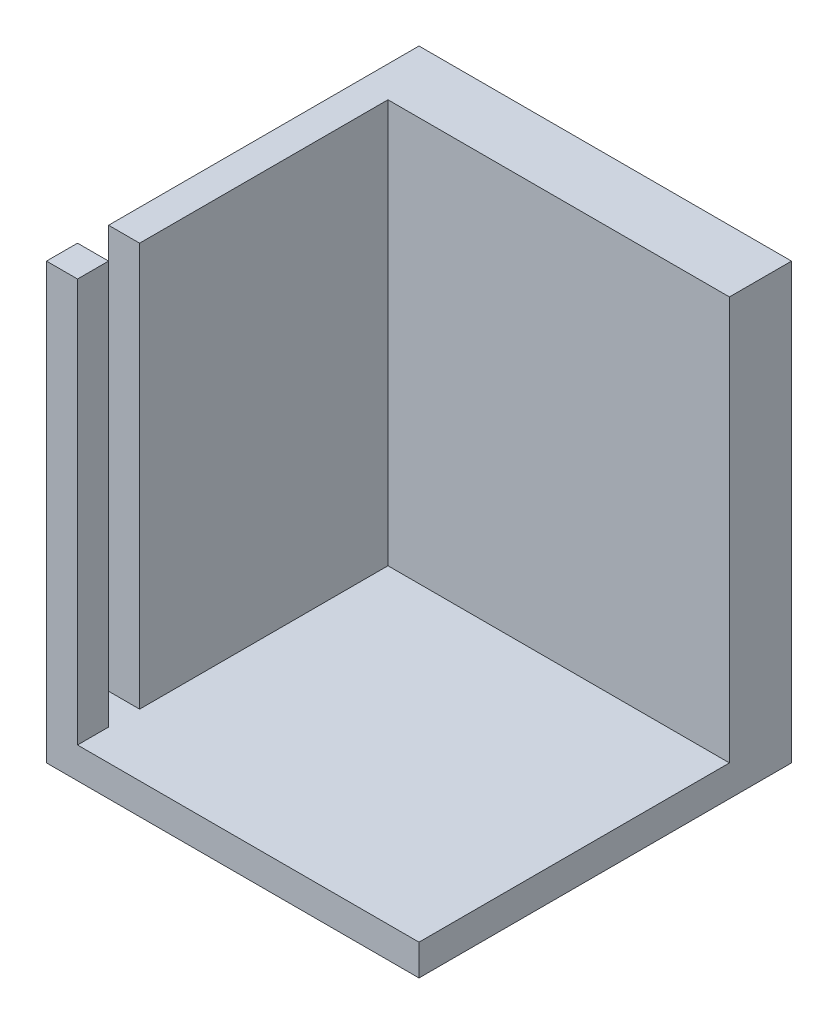
from build123d import *

# Parameters (mm, degrees)
SKETCH1_W                      = 670
SKETCH1_H                      = 120
BOSS_EXTRUDE1_DEPTH            = 530
SKETCH2_W                      = 100
SKETCH2_H                      = 200
SKETCH2_W_2                    = 650
SKETCH2_H_2                    = 250
CUT_EXTRUDE1_DEPTH             = 100
SKETCH3_R                      = 50
CUT_EXTRUDE2_DEPTH             = 260
F_12_0_12_DIAMETER_HOLE2_D     = 12
F_12_0_12_DIAMETER_HOLE2_DEPTH = 30
F_12_0_12_DIAMETER_HOLE2_TIP   = 3.605163714
SKETCH8_W                      = 650
SKETCH8_H                      = 50
BOSS_EXTRUDE2_DEPTH            = 5
SKETCH9_W                      = 10
SKETCH9_H                      = 250
CUT_EXTRUDE3_DEPTH             = 717
CUT_EXTRUDE4_DEPTH             = 5
SKETCH11_W                     = 10
SKETCH11_H                     = 100
BOSS_EXTRUDE3_DEPTH            = 78
BOSS_EXTRUDE3_2_DEPTH          = 78
BOSS_EXTRUDE3_3_DEPTH          = 78
SKETCH12_W                     = 20
SKETCH12_H                     = 30
CUT_EXTRUDE5_DEPTH             = 80
SKETCH15_W                     = 30
SKETCH15_H                     = 23.536156656
SKETCH15_H_2                   = 28.986603691
CUT_EXTRUDE7_DEPTH             = 35
SHELL1_T                       = -3
SKETCH16_W                     = 14
SKETCH16_H                     = 14
CUT_EXTRUDE8_DEPTH             = 35
SKETCH17_W                     = 5.729882812
SKETCH17_H                     = 17.428393554
SKETCH17_W_2                   = 13.369726562
SKETCH17_H_2                   = 3.342431641
BOSS_EXTRUDE4_DEPTH            = 5
CUT_EXTRUDE10_DEPTH            = 863.670273187
CUT_EXTRUDE10_DEPTH_BACK       = 863.670273187
SKETCH18_W                     = 670
SKETCH18_H                     = 250
CUT_EXTRUDE11_DEPTH            = 734.007503372
CUT_EXTRUDE11_DEPTH_BACK       = 734.007503372
SKETCH19_W                     = 550
SKETCH19_H                     = 280
CUT_EXTRUDE12_DEPTH            = 321.624390838
CUT_EXTRUDE12_DEPTH_BACK       = 321.624390838
SKETCH20_W                     = 120
SKETCH20_H                     = 140


with BuildPart() as part:
    # Sketch1 → Boss-Extrude1 (new body)
    with BuildSketch(Plane(origin=(0, 0, 0), x_dir=(1, 0, 0), z_dir=(0, 1, 0))):
        with Locations((335, 60)):
            Rectangle(SKETCH1_W, SKETCH1_H)
    extrude(amount=BOSS_EXTRUDE1_DEPTH)

    # Sketch2 → Cut-Extrude1 (cut)
    with BuildSketch(Plane.XY):
        with Locations((60, 380)):
            Rectangle(SKETCH2_W, SKETCH2_H)
        with Locations((170, 380)):
            Rectangle(SKETCH2_W, SKETCH2_H)
        with Locations((280, 380)):
            Rectangle(SKETCH2_W, SKETCH2_H)
        with Locations((390, 380)):
            Rectangle(SKETCH2_W, SKETCH2_H)
        with Locations((500, 380)):
            Rectangle(SKETCH2_W, SKETCH2_H)
        with Locations((610, 380)):
            Rectangle(SKETCH2_W, SKETCH2_H)
        with Locations((335, 135)):
            Rectangle(SKETCH2_W_2, SKETCH2_H_2)
    extrude(amount=-CUT_EXTRUDE1_DEPTH, mode=Mode.SUBTRACT)

    # Sketch3 → Cut-Extrude2 (cut)
    with BuildSketch(Plane(origin=(0, 530, 0), x_dir=(1, 0, 0), z_dir=(0, 1, 0))):
        with Locations(Location((60, 60, 0), (0, 0, 270))):
            Circle(SKETCH3_R)
        with Locations(Location((170, 60, 0), (0, 0, 270))):
            Circle(SKETCH3_R)
        with Locations(Location((280, 60, 0), (0, 0, 270))):
            Circle(SKETCH3_R)
        with Locations(Location((390, 60, 0), (0, 0, 270))):
            Circle(SKETCH3_R)
        with Locations(Location((500, 60, 0), (0, 0, 270))):
            Circle(SKETCH3_R)
        with Locations(Location((610, 60, 0), (0, 0, 270))):
            Circle(SKETCH3_R)
    extrude(amount=-CUT_EXTRUDE2_DEPTH, mode=Mode.SUBTRACT)

    # Ø12.0 (12) Diameter Hole2
    with Locations(Plane(origin=(59.704642413, 270, -102.411697903), x_dir=(0, 0, 1), z_dir=(0, 1, 0))):
        with Locations((0, 0), (-0.195888006, 111.8520513), (0.014838595, 221.167624818), (-0.341843303, 331.364008353), (0.657723149, 441.008646429), (1.288998006, 549.811854685)):
            Hole(F_12_0_12_DIAMETER_HOLE2_D / 2, depth=F_12_0_12_DIAMETER_HOLE2_DEPTH)
            with Locations((0, 0, -(F_12_0_12_DIAMETER_HOLE2_DEPTH + F_12_0_12_DIAMETER_HOLE2_TIP / 2))):  # 118° drill point
                Cone(0, F_12_0_12_DIAMETER_HOLE2_D / 2, F_12_0_12_DIAMETER_HOLE2_TIP, mode=Mode.SUBTRACT)

    # Sketch8 → Boss-Extrude2 (add)
    with BuildSketch(Plane.XY):
        with Locations((335, 305)):
            Rectangle(SKETCH8_W, SKETCH8_H)
    extrude(amount=-BOSS_EXTRUDE2_DEPTH)

    # Sketch9 → Cut-Extrude3 (cut)
    with BuildSketch(Plane(origin=(670, 0, 0), x_dir=(0, 0, -1), z_dir=(1, 0, 0))):
        with Locations((15, 135)):
            Rectangle(SKETCH9_W, SKETCH9_H)
    extrude(amount=-CUT_EXTRUDE3_DEPTH, mode=Mode.SUBTRACT)

    # Sketch10 → Cut-Extrude4 (cut)
    with BuildSketch(Plane(origin=(0, 10, 0), x_dir=(1, 0, 0), z_dir=(0, 1, 0))):
        Polygon((365, 61.943560596), (350, 87.924322709), (320, 87.924322709), (305, 61.943560596), (320, 35.962798482), (350, 35.962798482), align=None)
    extrude(amount=-CUT_EXTRUDE4_DEPTH, mode=Mode.SUBTRACT)

    # Sketch12 → Cut-Extrude5 (cut)
    with BuildSketch(Plane.XY.offset(-100)):
        with Locations((85.198613037, 245)):
            Rectangle(SKETCH12_W, SKETCH12_H)
        with Locations((195.198613037, 245)):
            Rectangle(SKETCH12_W, SKETCH12_H)
        with Locations((305.198613037, 245)):
            Rectangle(SKETCH12_W, SKETCH12_H)
        with Locations((415.198613037, 245)):
            Rectangle(SKETCH12_W, SKETCH12_H)
        with Locations((525.198613037, 245)):
            Rectangle(SKETCH12_W, SKETCH12_H)
        with Locations((635.198613037, 245)):
            Rectangle(SKETCH12_W, SKETCH12_H)
    extrude(amount=-CUT_EXTRUDE5_DEPTH, mode=Mode.SUBTRACT)

    # Sketch17 → Boss-Extrude4 (add)
    # profile 1 of 9: a face of its own
    with BuildSketch(Plane.XY):
        with BuildLine():
            Line((527.508830928, 289.835452458), (527.508830928, 307.263846012))
            Line((527.508830928, 307.263846012), (534.861434459, 307.263846012))
            add(Edge.make_bspline(
                [(534.861434459, 307.263846012), (535.181337774, 307.258256848), (535.803061116, 307.24739446), (536.703508491, 307.139069344), (537.544992916, 306.975202489), (538.325061607, 306.737496792), (539.040841948, 306.426020155), (539.698044515, 306.051894954), (540.290333057, 305.605079277), (540.822348212, 305.090232636), (541.284521701, 304.502523111), (541.692171296, 303.852565801), (542.030284458, 303.129762281), (542.309377095, 302.341316546), (542.5243908, 301.484161689), (542.679660381, 300.560045938), (542.773357357, 299.567500804), (542.783368073, 298.883107022), (542.788518428, 298.530997273)],
                knots=[0, 0, 0, 0, 1.135059408, 2.20595691, 3.214417064, 4.174978569, 5.094187092, 5.980001006, 6.853065862, 7.720814779, 8.600404634, 9.50058483, 10.438414914, 11.426825708, 12.465239141, 13.571113463, 14.750376389, 16, 16, 16, 16], degree=3))
            add(Edge.make_bspline(
                [(542.788518428, 298.530997273), (542.781740751, 298.180151665), (542.768592871, 297.499553336), (542.676885992, 296.511518461), (542.516733301, 295.591080531), (542.296748778, 294.736450427), (542.003051046, 293.953120444), (541.654236167, 293.233205539), (541.233025793, 292.585291498), (540.753136904, 292.000029304), (540.204772188, 291.484681411), (539.587651059, 291.044279297), (538.910779309, 290.668464036), (538.169670382, 290.361903209), (537.364073889, 290.124869172), (536.495133477, 289.954199984), (535.562644449, 289.853487388), (534.920131033, 289.841584621), (534.58911581, 289.835452458)],
                knots=[0, 0, 0, 0, 1.228418252, 2.382983832, 3.470276728, 4.496757894, 5.468023682, 6.394867725, 7.292157164, 8.167372942, 9.039072913, 9.918728341, 10.815246345, 11.744296628, 12.720973084, 13.750736166, 14.841206188, 16, 16, 16, 16], degree=3))
            Line((534.58911581, 289.835452458), (527.508830928, 289.835452458))
        make_face()
        with BuildLine():
            Line((533.238713741, 291.745413395), (534.048208904, 291.745413395))
            add(Edge.make_bspline(
                [(534.048208904, 291.745413395), (534.172894012, 291.749291978), (534.413033311, 291.756761998), (534.758676231, 291.825976613), (535.075745017, 291.938271137), (535.365749176, 292.094802589), (535.623404602, 292.300450923), (535.848862806, 292.551404902), (536.04776914, 292.844737637), (536.217685755, 293.190205032), (536.364284647, 293.596533622), (536.481764702, 294.076367921), (536.592118304, 294.630928744), (536.673672739, 295.265507643), (536.740044562, 295.978448886), (536.788346679, 296.768428292), (536.812018936, 297.636801208), (536.817188964, 298.241258393), (536.819890499, 298.55711002)],
                knots=[0, 0, 0, 0, 0.728710832, 1.403472396, 2.052289494, 2.690292559, 3.321919393, 3.970736491, 4.656696891, 5.388631723, 6.217040872, 7.17856157, 8.275589967, 9.523440737, 10.918935818, 12.463926104, 14.152268318, 16, 16, 16, 16], degree=3))
            add(Edge.make_bspline(
                [(536.819890499, 298.55711002), (536.8171426, 298.871715251), (536.811863063, 299.476166083), (536.7886758, 300.343334385), (536.739579947, 301.133216935), (536.674703848, 301.843934916), (536.589660404, 302.476324031), (536.488366458, 303.031681737), (536.362441588, 303.507627045), (536.222158727, 303.914921549), (536.050140993, 304.256514038), (535.858357073, 304.554097881), (535.62547107, 304.79746827), (535.36991257, 305.004888479), (535.079348843, 305.160875844), (534.761320266, 305.273944358), (534.414185903, 305.34216807), (534.172870641, 305.349893944), (534.048208904, 305.353885075)],
                knots=[0, 0, 0, 0, 1.842836665, 3.540640921, 5.080358154, 6.47765669, 7.719902824, 8.816971715, 9.781579111, 10.601733135, 11.334613876, 12.017393917, 12.666641099, 13.29908421, 13.937911793, 14.587567384, 15.270347425, 16, 16, 16, 16], degree=3))
            Line((534.048208904, 305.353885075), (533.238713741, 305.353885075))
            Line((533.238713741, 305.353885075), (533.238713741, 291.745413395))
        make_face(mode=Mode.SUBTRACT)
    # profile 2 of 9: a face of its own
    with BuildSketch(Plane.XY):
        with Locations((547.563420772, 298.549649235)):
            Rectangle(SKETCH17_W, SKETCH17_H)
    # profile 3 of 9: a face of its own
    with BuildSketch(Plane.XY):
        Polygon((564.514324092, 307.263846012), (564.514324092, 305.115139958), (558.545696163, 305.115139958), (558.545696163, 299.862747379), (563.559343624, 299.862747379), (563.559343624, 297.714041325), (558.545696163, 297.714041325), (558.545696163, 289.835452458), (552.81581335, 289.835452458), (552.81581335, 307.263846012), align=None)
    # profile 4 of 9: a face of its own
    with BuildSketch(Plane.XY):
        Polygon((577.645305538, 307.263846012), (577.645305538, 305.115139958), (571.676677608, 305.115139958), (571.676677608, 299.862747379), (576.690325069, 299.862747379), (576.690325069, 297.714041325), (571.676677608, 297.714041325), (571.676677608, 289.835452458), (565.946794795, 289.835452458), (565.946794795, 307.263846012), align=None)
    # profile 5 of 9: a face of its own
    with BuildSketch(Plane.XY):
        with Locations((584.330168819, 287.448001286)):
            Rectangle(SKETCH17_W_2, SKETCH17_H_2)
    # profile 6 of 9: a face of its own
    with BuildSketch(Plane.XY):
        with BuildLine():
            Line((605.578484249, 307.263846012), (605.578484249, 295.602639195))
            add(Edge.make_bspline(
                [(605.578484249, 295.602639195), (605.574209777, 295.35989389), (605.565919345, 294.889083964), (605.480877158, 294.20653885), (605.349958188, 293.569747554), (605.15926554, 292.978838165), (604.911867049, 292.436847071), (604.616163877, 291.936663973), (604.260702644, 291.487723021), (603.847299908, 291.08966617), (603.386881991, 290.731670113), (602.867295001, 290.425440037), (602.293741958, 290.168488385), (601.66690529, 289.960990771), (600.988052682, 289.797299786), (600.254912883, 289.679078851), (599.467035781, 289.60781007), (598.923618241, 289.60048219), (598.643684673, 289.59670734)],
                knots=[0, 0, 0, 0, 1.108173197, 2.149326602, 3.136215123, 4.073726706, 4.978516626, 5.852185058, 6.72141202, 7.584905625, 8.467554395, 9.379216169, 10.332422268, 11.332766067, 12.390653242, 13.518530507, 14.721707419, 16, 16, 16, 16], degree=3))
            add(Edge.make_bspline(
                [(598.643684673, 289.59670734), (598.373688491, 289.600411437), (597.851346557, 289.607577482), (597.093280473, 289.679448684), (596.387523889, 289.797736542), (595.733050135, 289.960122315), (595.130189942, 290.169220301), (594.579048171, 290.42623041), (594.078350789, 290.732835498), (593.633858028, 291.090104794), (593.234289459, 291.486851767), (592.899913678, 291.940746827), (592.609043638, 292.435866034), (592.375223767, 292.980322997), (592.191754821, 293.570441519), (592.063541006, 294.20666921), (591.983676196, 294.889343196), (591.974661767, 295.359932437), (591.970012569, 295.602639195)],
                knots=[0, 0, 0, 0, 1.258901956, 2.435505865, 3.547148904, 4.59359074, 5.576649289, 6.5183682, 7.424469602, 8.307507093, 9.172751023, 10.042627298, 10.928839176, 11.845659241, 12.799442865, 13.80597989, 14.868432463, 16, 16, 16, 16], degree=3))
            Line((591.970012569, 295.602639195), (591.970012569, 307.263846012))
            Line((591.970012569, 307.263846012), (597.699895381, 307.263846012))
            Line((597.699895381, 307.263846012), (597.699895381, 295.457153889))
            add(Edge.make_bspline(
                [(597.699895381, 295.457153889), (597.700816195, 295.287996189), (597.702584578, 294.963135903), (597.729908723, 294.499051493), (597.768241004, 294.079064133), (597.828226169, 293.705517832), (597.90066041, 293.377063412), (597.989882091, 293.09281535), (598.094998068, 292.852496478), (598.225239063, 292.654232043), (598.380826623, 292.495135011), (598.55368342, 292.353231761), (598.757556996, 292.238543846), (598.987648905, 292.146224908), (599.243380948, 292.070549638), (599.526120553, 292.020376099), (599.83553351, 291.990763905), (600.049971942, 291.986424568), (600.161954402, 291.984158512)],
                knots=[0, 0, 0, 0, 1.622370975, 3.115695595, 4.458049099, 5.666011203, 6.742434742, 7.681714947, 8.519814998, 9.250928664, 9.942747364, 10.646898194, 11.389596108, 12.175933929, 13.021386247, 13.943159715, 14.925891993, 16, 16, 16, 16], degree=3))
            add(Edge.make_bspline(
                [(600.161954402, 291.984158512), (600.283927219, 291.987190593), (600.521124756, 291.993087005), (600.86597014, 292.03390861), (601.187714881, 292.103380086), (601.484890424, 292.205377303), (601.758665297, 292.332852529), (602.012761516, 292.484567923), (602.236391413, 292.674631152), (602.439076761, 292.888441291), (602.620738276, 293.128529789), (602.771757722, 293.399928575), (602.905501548, 293.697121508), (603.005823683, 294.025060118), (603.089837826, 294.379999499), (603.146989706, 294.763086929), (603.186210275, 295.174074524), (603.189394751, 295.457053988), (603.191033077, 295.602639195)],
                knots=[0, 0, 0, 0, 1.083870311, 2.107775948, 3.08105344, 4.003637981, 4.893545291, 5.761570557, 6.624657808, 7.49233129, 8.376387281, 9.291996285, 10.246843261, 11.267344133, 12.334180325, 13.486053461, 14.706643157, 16, 16, 16, 16], degree=3))
            Line((603.191033077, 295.602639195), (603.191033077, 307.263846012))
            Line((603.191033077, 307.263846012), (605.578484249, 307.263846012))
        make_face()
    # profile 7 of 9: a face of its own
    with BuildSketch(Plane.XY):
        with BuildLine():
            Line((619.731593227, 302.015183827), (616.739818477, 301.526502415))
            add(Edge.make_bspline(
                [(616.739818477, 301.526502415), (616.748849224, 301.670726223), (616.765660669, 301.939210177), (616.78429066, 302.312269209), (616.796668381, 302.625642376), (616.798628236, 302.814722915), (616.799504756, 302.899286839)],
                knots=[0, 0, 0, 0, 1.261802504, 2.348944521, 3.261585937, 4, 4, 4, 4], degree=3))
            add(Edge.make_bspline(
                [(616.799504756, 302.899286839), (616.798306068, 303.007660677), (616.795968139, 303.219033721), (616.750451916, 303.523894877), (616.694806916, 303.811547356), (616.604352699, 304.076787391), (616.488181329, 304.320314265), (616.348943917, 304.543955606), (616.184187178, 304.745078709), (615.995833421, 304.928129987), (615.778009957, 305.083200131), (615.536269472, 305.218702836), (615.269765326, 305.333844758), (614.978065514, 305.431346685), (614.660683072, 305.504624438), (614.319025281, 305.556776695), (613.952471696, 305.585673441), (613.699597795, 305.590260771), (613.568984889, 305.592630192)],
                knots=[0, 0, 0, 0, 1.079280541, 2.105035848, 3.067950317, 3.99715044, 4.889989748, 5.753421302, 6.617030865, 7.476358039, 8.364190572, 9.274590025, 10.235106994, 11.254473582, 12.337095886, 13.478601727, 14.697662529, 16, 16, 16, 16], degree=3))
            add(Edge.make_bspline(
                [(613.568984889, 305.592630192), (613.391954632, 305.58912286), (613.059112606, 305.582528579), (612.595688488, 305.495339748), (612.198743126, 305.361419257), (611.87165349, 305.163811893), (611.613188167, 304.909795747), (611.433841092, 304.593316589), (611.323009072, 304.224665915), (611.313400221, 303.959558324), (611.308367061, 303.820693775)],
                knots=[0, 0, 0, 0, 1.294917039, 2.43462794, 3.440028966, 4.347597256, 5.210608309, 6.06356377, 6.985685997, 8, 8, 8, 8], degree=3))
            add(Edge.make_bspline(
                [(611.308367061, 303.820693775), (611.317562032, 303.705133219), (611.336106628, 303.472068433), (611.47315858, 303.132808312), (611.695999602, 302.811560885), (612.009295906, 302.510664216), (612.404107796, 302.221967273), (612.884407504, 301.948533431), (613.450813789, 301.688189695), (613.862519081, 301.536023727), (614.080048656, 301.455624958)],
                knots=[0, 0, 0, 0, 0.716839541, 1.445735977, 2.240793036, 3.131329288, 4.131129903, 5.273471266, 6.559404876, 8, 8, 8, 8], degree=3))
            add(Edge.make_bspline(
                [(614.080048656, 301.455624958), (614.335934702, 301.364918412), (614.834564244, 301.188164095), (615.547657928, 300.88707802), (616.213068388, 300.5749594), (616.829579094, 300.246613346), (617.397833174, 299.90520698), (617.914851624, 299.544556457), (618.386199073, 299.173962102), (618.807001026, 298.783874588), (619.177995113, 298.378100064), (619.4958685, 297.952745357), (619.771807525, 297.51723103), (619.991113975, 297.061458502), (620.169645242, 296.594624218), (620.292698657, 296.11024444), (620.364288243, 295.609761088), (620.37516617, 295.270864226), (620.380681514, 295.099036213)],
                knots=[0, 0, 0, 0, 1.359488612, 2.649152603, 3.874964776, 5.039588756, 6.146130126, 7.193090393, 8.194917302, 9.146793662, 10.063845301, 10.944476293, 11.803344532, 12.641736646, 13.473440096, 14.302714936, 15.139439897, 16, 16, 16, 16], degree=3))
            add(Edge.make_bspline(
                [(620.380681514, 295.099036213), (620.374476075, 294.902306495), (620.362285176, 294.515820995), (620.280160209, 293.948630617), (620.138011896, 293.409496554), (619.938489338, 292.895972278), (619.681049879, 292.411946655), (619.366518754, 291.954381076), (618.996510229, 291.525099427), (618.5710008, 291.128381035), (618.102222518, 290.765302239), (617.587803957, 290.450854345), (617.034458515, 290.187092261), (616.444107988, 289.968993032), (615.81453624, 289.801373099), (615.145337453, 289.685291013), (614.438790193, 289.606619894), (613.954683001, 289.600062276), (613.70700941, 289.59670734)],
                knots=[0, 0, 0, 0, 0.972121714, 1.909782367, 2.824924061, 3.721832975, 4.62620438, 5.527836938, 6.46026819, 7.421000932, 8.398101015, 9.385579713, 10.394244048, 11.422703992, 12.491421888, 13.608778581, 14.776629625, 16, 16, 16, 16], degree=3))
            add(Edge.make_bspline(
                [(613.70700941, 289.59670734), (613.445745367, 289.599650312), (612.939893069, 289.605348413), (612.207608113, 289.66709241), (611.525297432, 289.760984454), (610.893395078, 289.899706116), (610.309273131, 290.072394336), (609.776099392, 290.288320955), (609.295310255, 290.547303481), (608.863217672, 290.843007892), (608.478306623, 291.175775461), (608.148120946, 291.551766865), (607.86942369, 291.967163224), (607.639947144, 292.421521488), (607.466477665, 292.917583541), (607.339164663, 293.449829748), (607.264537999, 294.021332449), (607.254747521, 294.414908557), (607.249700069, 294.617815586)],
                knots=[0, 0, 0, 0, 1.342201143, 2.598733168, 3.773451092, 4.878874364, 5.91991243, 6.900006476, 7.829142054, 8.72062616, 9.585588575, 10.436728592, 11.283829734, 12.149664931, 13.044964919, 13.977937424, 14.957531465, 16, 16, 16, 16], degree=3))
            add(Edge.make_bspline(
                [(607.249700069, 294.617815586), (607.250803815, 294.692425759), (607.253213998, 294.855347393), (607.260452266, 295.122772538), (607.275636683, 295.433682216), (607.29037174, 295.656130545), (607.298195171, 295.774237248)],
                knots=[0, 0, 0, 0, 0.773500207, 1.689044709, 2.77302154, 4, 4, 4, 4], degree=3))
            Line((607.298195171, 295.774237248), (610.36457777, 296.337526509))
            add(Edge.make_bspline(
                [(610.36457777, 296.337526509), (610.326952988, 296.136337493), (610.255606535, 295.754830366), (610.178678473, 295.21219969), (610.124206629, 294.733311493), (610.11767002, 294.435147371), (610.114641475, 294.297001835)],
                knots=[0, 0, 0, 0, 1.192988372, 2.262218769, 3.194850416, 4, 4, 4, 4], degree=3))
            add(Edge.make_bspline(
                [(610.114641475, 294.297001835), (610.116191817, 294.183708768), (610.119182568, 293.965156219), (610.159053378, 293.648552813), (610.215988606, 293.352999663), (610.302906772, 293.079707227), (610.411206928, 292.826307836), (610.544682453, 292.59538211), (610.704385489, 292.386485019), (610.887496571, 292.200099922), (611.094689168, 292.033628705), (611.327456494, 291.892756696), (611.58347653, 291.771733922), (611.864681562, 291.677479524), (612.167961721, 291.596080628), (612.497219749, 291.548235723), (612.849461228, 291.512043782), (613.092629543, 291.508500084), (613.218327999, 291.506668278)],
                knots=[0, 0, 0, 0, 1.135776692, 2.191015738, 3.19649269, 4.151244236, 5.061952528, 5.956281389, 6.819534407, 7.692823504, 8.571441916, 9.478554956, 10.416037156, 11.406231466, 12.450054172, 13.561596327, 14.739541482, 16, 16, 16, 16], degree=3))
            add(Edge.make_bspline(
                [(613.218327999, 291.506668278), (613.423996012, 291.510791273), (613.810619321, 291.518541853), (614.349272542, 291.616708407), (614.810575885, 291.768742445), (615.189785268, 291.991387532), (615.490778961, 292.278756613), (615.698005174, 292.637320004), (615.824813318, 293.05638326), (615.837728413, 293.355975238), (615.844524288, 293.513619419)],
                knots=[0, 0, 0, 0, 1.308765556, 2.460272085, 3.475015317, 4.388076298, 5.239673503, 6.095681635, 6.997954785, 8, 8, 8, 8], degree=3))
            add(Edge.make_bspline(
                [(615.844524288, 293.513619419), (615.833808824, 293.638242951), (615.811807312, 293.894126055), (615.644884004, 294.264515838), (615.382382362, 294.620631473), (615.016807277, 294.962984909), (614.551376589, 295.293471235), (613.986957743, 295.616730224), (613.322148235, 295.933112033), (612.83677959, 296.119639164), (612.580430889, 296.21815395)],
                knots=[0, 0, 0, 0, 0.667930748, 1.371427933, 2.146459016, 3.034714139, 4.04893387, 5.207327294, 6.525042705, 8, 8, 8, 8], degree=3))
            add(Edge.make_bspline(
                [(612.580430889, 296.21815395), (612.374354345, 296.29679374), (611.970646869, 296.450850434), (611.394079385, 296.713586304), (610.853066711, 296.987016804), (610.357486361, 297.288235735), (609.896382561, 297.599610528), (609.477036946, 297.932256792), (609.09841673, 298.284556341), (608.758710772, 298.653375077), (608.457302107, 299.038989264), (608.199448649, 299.444659231), (607.977533299, 299.866789834), (607.798609588, 300.308107488), (607.65975715, 300.767821241), (607.559616231, 301.244439392), (607.497905054, 301.739995674), (607.491630423, 302.075933546), (607.488445186, 302.246468159)],
                knots=[0, 0, 0, 0, 1.249558333, 2.447906163, 3.58867143, 4.682264114, 5.731748367, 6.739728761, 7.711906036, 8.659384707, 9.578321416, 10.481344598, 11.379544271, 12.277135726, 13.175418307, 14.097160112, 15.034047388, 16, 16, 16, 16], degree=3))
            add(Edge.make_bspline(
                [(607.488445186, 302.246468159), (607.49282555, 302.439538736), (607.501402184, 302.817565692), (607.587451154, 303.36980586), (607.719291893, 303.894921371), (607.910558542, 304.389343064), (608.156192894, 304.852853762), (608.453187669, 305.288766511), (608.804241719, 305.697593471), (609.213503754, 306.066686531), (609.657214714, 306.407618241), (610.14376173, 306.697651931), (610.658716537, 306.950861947), (611.210636666, 307.148827868), (611.791820619, 307.313252612), (612.408080529, 307.421140415), (613.056315391, 307.490701612), (613.499160755, 307.498567824), (613.725661373, 307.502591129)],
                knots=[0, 0, 0, 0, 1.01033566, 1.978209831, 2.919499157, 3.840961976, 4.746855014, 5.660740114, 6.597989116, 7.56120833, 8.541877795, 9.523498025, 10.522416858, 11.542172371, 12.589598349, 13.681636521, 14.814234488, 16, 16, 16, 16], degree=3))
            add(Edge.make_bspline(
                [(613.725661373, 307.502591129), (613.968269855, 307.498219033), (614.438190994, 307.489750488), (615.120391152, 307.426787419), (615.755073228, 307.319142339), (616.345153155, 307.171557286), (616.887304575, 306.977590666), (617.384933999, 306.742393454), (617.834452216, 306.46201507), (618.236961315, 306.139451502), (618.593086714, 305.773322851), (618.897467704, 305.361641069), (619.158701245, 304.909408454), (619.366684143, 304.412232174), (619.529870326, 303.873247147), (619.649133834, 303.29158184), (619.720420497, 302.667301443), (619.72779778, 302.236712324), (619.731593227, 302.015183827)],
                knots=[0, 0, 0, 0, 1.248314423, 2.417925914, 3.521398822, 4.558068205, 5.543720209, 6.479599284, 7.385061127, 8.263440163, 9.127722873, 10.00561236, 10.891325273, 11.808802823, 12.772251995, 13.784947978, 14.860405143, 16, 16, 16, 16], degree=3))
        make_face()
    # profile 8 of 9: a face of its own
    with BuildSketch(Plane.XY):
        Polygon((633.989153194, 307.263846012), (633.989153194, 305.115139958), (628.020525264, 305.115139958), (628.020525264, 300.340237614), (633.034172725, 300.340237614), (633.034172725, 298.191531559), (628.020525264, 298.191531559), (628.020525264, 291.984158512), (634.944133663, 291.984158512), (634.944133663, 289.835452458), (622.290642452, 289.835452458), (622.290642452, 307.263846012), align=None)
    # profile 9 of 9: a face of its own
    with BuildSketch(Plane.XY):
        with BuildLine():
            Line((636.376604366, 289.835452458), (636.376604366, 307.263846012))
            Line((636.376604366, 307.263846012), (643.990335369, 307.263846012))
            add(Edge.make_bspline(
                [(643.990335369, 307.263846012), (644.237946498, 307.261150834), (644.721600887, 307.25588639), (645.426490561, 307.189203683), (646.094808274, 307.090496236), (646.724915796, 306.949857504), (647.317873659, 306.767252686), (647.871119087, 306.542146), (648.390701058, 306.282329135), (648.864494846, 305.976472528), (649.295093616, 305.642889252), (649.669668547, 305.279483604), (649.990389523, 304.894749072), (650.250664962, 304.483256345), (650.454275633, 304.048690948), (650.59581384, 303.587791605), (650.684089268, 303.104102537), (650.695510601, 302.772834174), (650.701311397, 302.604585835)],
                knots=[0, 0, 0, 0, 1.303269877, 2.545653735, 3.724355284, 4.8584284, 5.941462088, 6.987020715, 8.000098032, 8.995332524, 9.951400474, 10.863507538, 11.737823931, 12.582415999, 13.420128714, 14.25671499, 15.114600608, 16, 16, 16, 16], degree=3))
            add(Edge.make_bspline(
                [(650.701311397, 302.604585835), (650.698282873, 302.472674957), (650.692382063, 302.215658276), (650.651041486, 301.838684287), (650.580643818, 301.480313933), (650.481036683, 301.139915259), (650.347814833, 300.820175594), (650.191279492, 300.517863507), (650.009772227, 300.230553342), (649.788675198, 299.970497982), (649.548268341, 299.722842359), (649.274558803, 299.497116911), (648.974487035, 299.288655528), (648.642526299, 299.104010513), (648.287619671, 298.928055749), (647.899038177, 298.784921972), (647.486819978, 298.644749395), (647.19793098, 298.577036306), (647.049257183, 298.54218845)],
                knots=[0, 0, 0, 0, 1.057156483, 2.059775939, 3.035078039, 3.981068617, 4.897189472, 5.80650904, 6.70770952, 7.613691521, 8.536886357, 9.470937334, 10.45233069, 11.461024139, 12.51295332, 13.623444893, 14.776929983, 16, 16, 16, 16], degree=3))
            add(Edge.make_bspline(
                [(647.049257183, 298.54218845), (647.19164695, 298.499279419), (647.467865022, 298.416041346), (647.856360945, 298.265600017), (648.211652989, 298.111536308), (648.524185739, 297.936781388), (648.807636894, 297.762122504), (649.047122259, 297.564301324), (649.255235567, 297.361673563), (649.425188343, 297.135464734), (649.570253643, 296.882344437), (649.694827156, 296.586596707), (649.815179167, 296.247423665), (649.917667348, 295.859098311), (650.004750555, 295.423699276), (650.088222437, 294.944027189), (650.153853601, 294.416024546), (650.187587341, 294.048412906), (650.2051692, 293.856815525)],
                knots=[0, 0, 0, 0, 1.149282524, 2.229462177, 3.219229774, 4.139917433, 4.995948464, 5.788695735, 6.536448429, 7.236319808, 7.968460079, 8.78645307, 9.713791991, 10.749194692, 11.887975363, 13.146018663, 14.512518948, 16, 16, 16, 16], degree=3))
            add(Edge.make_bspline(
                [(650.2051692, 293.856815525), (650.225980287, 293.627849833), (650.265975604, 293.187817268), (650.348933081, 292.554613589), (650.44386163, 291.974357025), (650.555874504, 291.44528724), (650.681301216, 290.967898855), (650.821280597, 290.540469593), (650.979920039, 290.165788217), (651.10484481, 289.941461656), (651.163880062, 289.835452458)],
                knots=[0, 0, 0, 0, 1.324580516, 2.545615266, 3.678710841, 4.711533017, 5.660403917, 6.521349952, 7.301239649, 8, 8, 8, 8], degree=3))
            Line((651.163880062, 289.835452458), (645.213904094, 289.835452458))
            add(Edge.make_bspline(
                [(645.213904094, 289.835452458), (645.12229736, 290.069847279), (644.935171241, 290.548648246), (644.7595281, 291.319414791), (644.64846922, 292.142514735), (644.635117598, 292.70994511), (644.628232479, 293.002555653)],
                knots=[0, 0, 0, 0, 0.930410518, 1.900560147, 2.917368081, 4, 4, 4, 4], degree=3))
            Line((644.628232479, 293.002555653), (644.605850124, 294.002300831))
            Line((644.605850124, 294.002300831), (644.579737377, 295.266903874))
            add(Edge.make_bspline(
                [(644.579737377, 295.266903874), (644.573694669, 295.477395004), (644.562357007, 295.872330118), (644.469348432, 296.426164013), (644.30178735, 296.894645884), (644.073222546, 297.287223005), (643.766741442, 297.590613479), (643.39104803, 297.804152917), (642.950456912, 297.93396284), (642.634664848, 297.946292392), (642.468335247, 297.952786442)],
                knots=[0, 0, 0, 0, 1.295300309, 2.430314163, 3.439929415, 4.342995669, 5.203512789, 6.060756153, 6.978588463, 8, 8, 8, 8], degree=3))
            Line((642.468335247, 297.952786442), (642.106487178, 297.952786442))
            Line((642.106487178, 297.952786442), (642.106487178, 289.835452458))
            Line((642.106487178, 289.835452458), (636.376604366, 289.835452458))
        make_face()
        with BuildLine():
            Line((642.106487178, 299.862747379), (642.617550945, 299.862747379))
            add(Edge.make_bspline(
                [(642.617550945, 299.862747379), (642.722054451, 299.865172716), (642.925280724, 299.869889229), (643.220054897, 299.898289891), (643.494111408, 299.951809873), (643.749840966, 300.021017819), (643.984372137, 300.114851792), (644.200147241, 300.225818296), (644.391160406, 300.362685327), (644.565327067, 300.516342321), (644.718148635, 300.691986294), (644.850351299, 300.889034217), (644.961199162, 301.106225057), (645.056078491, 301.342818683), (645.125883912, 301.600830857), (645.173262731, 301.879472914), (645.203404658, 302.177423605), (645.207875435, 302.383174491), (645.210173702, 302.488943669)],
                knots=[0, 0, 0, 0, 1.184986479, 2.304423995, 3.352332712, 4.347714965, 5.303263624, 6.211353909, 7.091434645, 7.960150225, 8.839440182, 9.723126897, 10.64371617, 11.599264829, 12.608232147, 13.667459739, 14.800924404, 16, 16, 16, 16], degree=3))
            add(Edge.make_bspline(
                [(645.210173702, 302.488943669), (645.207875435, 302.594712847), (645.203404658, 302.800463732), (645.173262731, 303.098414423), (645.125883912, 303.37705648), (645.056078491, 303.635068654), (644.961199162, 303.87166228), (644.850351299, 304.08885312), (644.718148635, 304.285901043), (644.565327067, 304.461545017), (644.391160406, 304.61520201), (644.200147241, 304.752069041), (643.984372137, 304.863035546), (643.749840966, 304.956869518), (643.494111408, 305.026077464), (643.220054897, 305.079597446), (642.925280724, 305.107998108), (642.722054451, 305.112714621), (642.617550945, 305.115139958)],
                knots=[0, 0, 0, 0, 1.199075596, 2.332540261, 3.391767853, 4.400735171, 5.35628383, 6.276873103, 7.160559818, 8.039849775, 8.908565355, 9.788646091, 10.696736376, 11.652285035, 12.647667288, 13.695576005, 14.815013521, 16, 16, 16, 16], degree=3))
            Line((642.617550945, 305.115139958), (642.106487178, 305.115139958))
            Line((642.106487178, 305.115139958), (642.106487178, 299.862747379))
        make_face(mode=Mode.SUBTRACT)
    extrude(amount=BOSS_EXTRUDE4_DEPTH)

    # Sketch18 → Cut-Extrude10 (cut, two sides: drawn at the far end of the back side and taken through both)
    with BuildSketch(Plane.XY.offset(-CUT_EXTRUDE10_DEPTH_BACK)):
        with Locations((335, 405)):
            Rectangle(SKETCH18_W, SKETCH18_H)
    extrude(amount=CUT_EXTRUDE10_DEPTH + CUT_EXTRUDE10_DEPTH_BACK, mode=Mode.SUBTRACT)

    # Sketch19 → Cut-Extrude11 (cut, two sides: drawn at the far end of the back side and taken through both)
    with BuildSketch(Plane.XY.offset(-100).offset(-CUT_EXTRUDE11_DEPTH_BACK)):
        with Locations((395, 140)):
            Rectangle(SKETCH19_W, SKETCH19_H)
    extrude(amount=CUT_EXTRUDE11_DEPTH + CUT_EXTRUDE11_DEPTH_BACK, mode=Mode.SUBTRACT)

    # Sketch20 → Cut-Extrude12 (cut, two sides: drawn at the far end of the back side and taken through both)
    with BuildSketch(Plane.XY.offset(-100).offset(-CUT_EXTRUDE12_DEPTH_BACK)):
        with Locations((60, 210)):
            Rectangle(SKETCH20_W, SKETCH20_H)
    extrude(amount=CUT_EXTRUDE12_DEPTH + CUT_EXTRUDE12_DEPTH_BACK, mode=Mode.SUBTRACT)


with BuildPart() as body_2:
    # Sketch11 → Boss-Extrude3 (new body)
    with BuildSketch(Plane.XY.offset(-100)):
        with Locations((255, 60)):
            Rectangle(SKETCH11_W, SKETCH11_H)
    extrude(amount=BOSS_EXTRUDE3_DEPTH)


with BuildPart() as body_3:
    # Sketch11 → Boss-Extrude3 2 (new body)
    with BuildSketch(Plane.XY.offset(-100)):
        with Locations((415, 60)):
            Rectangle(SKETCH11_W, SKETCH11_H)
    extrude(amount=BOSS_EXTRUDE3_2_DEPTH)


with BuildPart() as body_4:
    # Sketch11 → Boss-Extrude3 3 (new body)
    with BuildSketch(Plane.XY.offset(-100)):
        Polygon((25, 198.45686471), (325, 145.558770497), (325, 122.01775856), (345, 122.01775856), (345, 145.558770497), (645, 198.45686471), align=None)
    extrude(amount=BOSS_EXTRUDE3_3_DEPTH)

    # Sketch15 → Cut-Extrude7 (cut)
    with BuildSketch(Plane(origin=(345, 0, 0), x_dir=(0, 0, -1), z_dir=(1, 0, 0))):
        with Locations((35, 133.231921672)):
            Rectangle(SKETCH15_W, SKETCH15_H)
        with Locations((85, 130.506698154)):
            Rectangle(SKETCH15_W, SKETCH15_H_2)
    extrude(amount=-CUT_EXTRUDE7_DEPTH, mode=Mode.SUBTRACT)

    # Shell1
    shell1_openings = [body_4.faces().sort_by_distance(p)[0] for p in [
        (335, 198.45686471, -61),
    ]]
    offset(amount=SHELL1_T, openings=shell1_openings, kind=Kind.INTERSECTION)

    # Sketch16 → Cut-Extrude8 (cut)
    with BuildSketch(Plane.XZ.offset(-122.01775856)):
        with Locations((335, -60)):
            Rectangle(SKETCH16_W, SKETCH16_H)
    extrude(amount=-CUT_EXTRUDE8_DEPTH, mode=Mode.SUBTRACT)


solid = part.part
